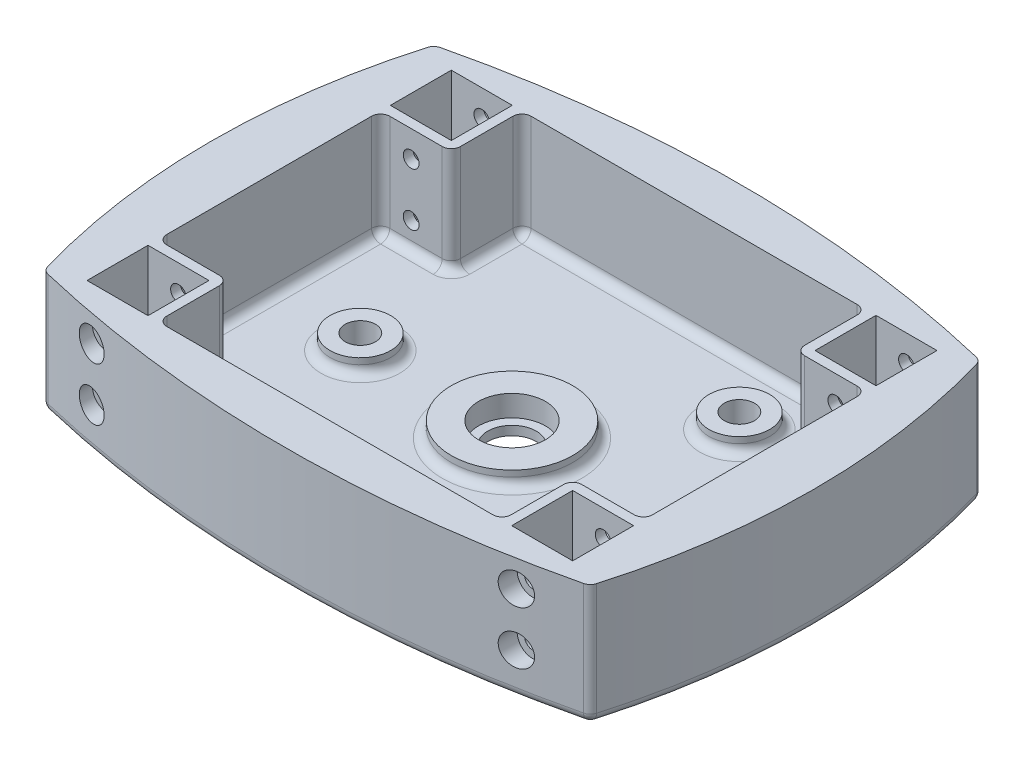
from build123d import *

# Parameters (mm, degrees)
SKETCH1_W           = 20.1
SKETCH1_H           = 20.1
BOSS_EXTRUDE1_DEPTH = 40
SKETCH1_3_R         = 10
SKETCH1_3_R_2       = 20
BOSS_EXTRUDE2_DEPTH = 5
SKETCH1_4_R         = 11
SKETCH1_4_R_2       = 8
SKETCH1_4_W         = 20.1
SKETCH1_4_H         = 20.1
BOSS_EXTRUDE3_DEPTH = 3
SKETCH2_R           = 5.05
CUT_EXTRUDE1_DEPTH  = 62
SKETCH1_6_R         = 20
SKETCH1_6_R_2       = 11
SKETCH1_6_R_3       = 10
SKETCH1_6_R_4       = 5
BOSS_EXTRUDE4_DEPTH = 10
SKETCH2_3_R         = 5.05
SKETCH2_3_R_2       = 2.6
BOSS_EXTRUDE5_DEPTH = 26.5
SKETCH2_4_R         = 5.05
SKETCH2_4_R_2       = 2.6
CUT_EXTRUDE2_DEPTH  = 23.3
SKETCH2_5_R         = 5.05
SKETCH2_5_R_2       = 2.6
BOSS_EXTRUDE6_DEPTH = 3.2
SKETCH2_6_R         = 5.05
SKETCH2_6_R_2       = 2.6
CUT_EXTRUDE3_DEPTH  = 127.2
SKETCH2_7_R         = 5.05
SKETCH2_7_R_2       = 2.6
BOSS_EXTRUDE7_DEPTH = 100
SKETCH2_8_R         = 5.05
SKETCH2_8_R_2       = 2.6
CUT_EXTRUDE4_DEPTH  = 96.8
SKETCH2_9_R         = 5.05
SKETCH2_9_R_2       = 2.6
BOSS_EXTRUDE8_DEPTH = 76.7
SKETCH2_10_R        = 5.05
SKETCH2_10_R_2      = 2.6
CUT_EXTRUDE5_DEPTH  = 73.5
FILLET1_R           = 3


with BuildPart() as part:
    # Sketch1 → Boss-Extrude1 (new body)
    with BuildSketch(Plane(origin=(0, 0, 0), x_dir=(1, 0, 0), z_dir=(0, 1, 0))):
        with BuildLine():
            ThreePointArc((-160, 14.285714286), (-70, 25.097415446), (20, 14.285714286))
            ThreePointArc((20, 14.285714286), (29.379159313, -50), (20, -114.285714286))
            ThreePointArc((20, -114.285714286), (-70, -125.097415446), (-160, -114.285714286))
            ThreePointArc((-160, -114.285714286), (-169.379159313, -50), (-160, 14.285714286))
        make_face()
        with Locations((-140, 0)):
            Rectangle(SKETCH1_W, SKETCH1_H, mode=Mode.SUBTRACT)
        Rectangle(SKETCH1_W, SKETCH1_H, mode=Mode.SUBTRACT)
        with Locations((-140, -100)):
            Rectangle(SKETCH1_W, SKETCH1_H, mode=Mode.SUBTRACT)
        with Locations((0, -100)):
            Rectangle(SKETCH1_W, SKETCH1_H, mode=Mode.SUBTRACT)
        Polygon((-126.75, 10.05), (-126.75, -13.25), (-150.05, -13.25), (-150.05, -86.75), (-126.75, -86.75), (-126.75, -110.05), (-13.25, -110.05), (-13.25, -86.75), (10.05, -86.75), (10.05, -13.25), (-13.25, -13.25), (-13.25, 10.05), align=None, mode=Mode.SUBTRACT)
    extrude(amount=BOSS_EXTRUDE1_DEPTH)

    # Sketch1<3> → Boss-Extrude2 (add)
    with BuildSketch(Plane(origin=(0, 0, 0), x_dir=(1, 0, 0), z_dir=(0, 1, 0))):
        Polygon((-13.25, 10.05), (-126.75, 10.05), (-126.75, -13.25), (-150.05, -13.25), (-150.05, -86.75), (-126.75, -86.75), (-126.75, -110.05), (-13.25, -110.05), (-13.25, -86.75), (10.05, -86.75), (10.05, -13.25), (-13.25, -13.25), align=None)
        with Locations(Location((-120, -50, 0), (0, 0, 270))):
            Circle(SKETCH1_3_R, mode=Mode.SUBTRACT)
        with Locations(Location((-70, -50, 0), (0, 0, 270))):
            Circle(SKETCH1_3_R_2, mode=Mode.SUBTRACT)
        with Locations(Location((-35, -89.95, 0), (0, 0, 270))):
            Circle(SKETCH1_3_R, mode=Mode.SUBTRACT)
        with Locations(Location((-35, -10.05, 0), (0, 0, 270))):
            Circle(SKETCH1_3_R, mode=Mode.SUBTRACT)
    extrude(amount=BOSS_EXTRUDE2_DEPTH)

    # Sketch1<4> → Boss-Extrude3 (add)
    # profile 1 of 5: a face of its own
    with BuildSketch(Plane(origin=(0, 0, 0), x_dir=(1, 0, 0), z_dir=(0, 1, 0))):
        with Locations(Location((-70, -50, 0), (0, 0, 270))):
            Circle(SKETCH1_4_R)
        with Locations(Location((-70, -50, 0), (0, 0, 270))):
            Circle(SKETCH1_4_R_2, mode=Mode.SUBTRACT)
    # profile 2 of 5: a face of its own
    with BuildSketch(Plane(origin=(0, 0, 0), x_dir=(1, 0, 0), z_dir=(0, 1, 0))):
        with Locations((-140, 0)):
            Rectangle(SKETCH1_4_W, SKETCH1_4_H)
    # profile 3 of 5: a face of its own
    with BuildSketch(Plane(origin=(0, 0, 0), x_dir=(1, 0, 0), z_dir=(0, 1, 0))):
        with Locations((-140, -100)):
            Rectangle(SKETCH1_4_W, SKETCH1_4_H)
    # profile 4 of 5: a face of its own
    with BuildSketch(Plane(origin=(0, 0, 0), x_dir=(1, 0, 0), z_dir=(0, 1, 0))):
        Rectangle(SKETCH1_4_W, SKETCH1_4_H)
    # profile 5 of 5: a face of its own
    with BuildSketch(Plane(origin=(0, 0, 0), x_dir=(1, 0, 0), z_dir=(0, 1, 0))):
        with Locations((0, -100)):
            Rectangle(SKETCH1_4_W, SKETCH1_4_H)
    extrude(amount=BOSS_EXTRUDE3_DEPTH)


with BuildPart() as boss_extrude3_piece_1:
    # of the separate pieces the step leaves, piece 1, a body of its own (boss_extrude3_pieces)
    add(part.part.solids().sort_by_distance((-160, 0, 114.285714286))[0])

    # Sketch2 → Cut-Extrude1 (cut)
    with BuildSketch(Plane.XY.offset(13.25)):
        with Locations((0, 13.75)):
            Circle(SKETCH2_R)
        with Locations((0, 31.25)):
            Circle(SKETCH2_R)
        with Locations((-140, 31.25)):
            Circle(SKETCH2_R)
        with Locations((-140, 13.75)):
            Circle(SKETCH2_R)
    extrude(amount=-CUT_EXTRUDE1_DEPTH, mode=Mode.SUBTRACT)



with BuildPart() as boss_extrude3_piece_2:
    # of the separate pieces the step leaves, piece 2, a body of its own (boss_extrude3_pieces)
    add(part.part.solids().sort_by_distance((-70, 0, 61))[0])


with BuildPart() as boss_extrude3_piece_1_1:
    add(boss_extrude3_piece_1.part)

    add(boss_extrude3_piece_2.part)  # Boss-Extrude4 merges Boss-Extrude3 piece 2
    # Sketch1<6> → Boss-Extrude4 (add)
    # profile 1 of 4: a face of its own
    with BuildSketch(Plane(origin=(0, 0, 0), x_dir=(1, 0, 0), z_dir=(0, 1, 0))):
        with Locations(Location((-70, -50, 0), (0, 0, 270))):
            Circle(SKETCH1_6_R)
        with Locations(Location((-70, -50, 0), (0, 0, 270))):
            Circle(SKETCH1_6_R_2, mode=Mode.SUBTRACT)
    # profile 2 of 4: a face of its own
    with BuildSketch(Plane(origin=(0, 0, 0), x_dir=(1, 0, 0), z_dir=(0, 1, 0))):
        with Locations(Location((-120, -50, 0), (0, 0, 270))):
            Circle(SKETCH1_6_R_3)
        with Locations(Location((-120, -50, 0), (0, 0, 270))):
            Circle(SKETCH1_6_R_4, mode=Mode.SUBTRACT)
    # profile 3 of 4: a face of its own
    with BuildSketch(Plane(origin=(0, 0, 0), x_dir=(1, 0, 0), z_dir=(0, 1, 0))):
        with Locations(Location((-35, -10.05, 0), (0, 0, 270))):
            Circle(SKETCH1_6_R_3)
        with Locations(Location((-35, -10.05, 0), (0, 0, 270))):
            Circle(SKETCH1_6_R_4, mode=Mode.SUBTRACT)
    # profile 4 of 4: a face of its own
    with BuildSketch(Plane(origin=(0, 0, 0), x_dir=(1, 0, 0), z_dir=(0, 1, 0))):
        with Locations(Location((-35, -89.95, 0), (0, 0, 270))):
            Circle(SKETCH1_6_R_3)
        with Locations(Location((-35, -89.95, 0), (0, 0, 270))):
            Circle(SKETCH1_6_R_4, mode=Mode.SUBTRACT)
    extrude(amount=BOSS_EXTRUDE4_DEPTH)

    # Sketch2<3> → Boss-Extrude5 (add)
    # profile 1 of 4: a face of its own
    with BuildSketch(Plane.XY.offset(13.25)):
        with Locations((0, 13.75)):
            Circle(SKETCH2_3_R)
        with Locations((0, 13.75)):
            Circle(SKETCH2_3_R_2, mode=Mode.SUBTRACT)
    # profile 2 of 4: a face of its own
    with BuildSketch(Plane.XY.offset(13.25)):
        with Locations((0, 31.25)):
            Circle(SKETCH2_3_R)
        with Locations((0, 31.25)):
            Circle(SKETCH2_3_R_2, mode=Mode.SUBTRACT)
    # profile 3 of 4: a face of its own
    with BuildSketch(Plane.XY.offset(13.25)):
        with Locations((-140, 31.25)):
            Circle(SKETCH2_3_R)
        with Locations((-140, 31.25)):
            Circle(SKETCH2_3_R_2, mode=Mode.SUBTRACT)
    # profile 4 of 4: a face of its own
    with BuildSketch(Plane.XY.offset(13.25)):
        with Locations((-140, 13.75)):
            Circle(SKETCH2_3_R)
        with Locations((-140, 13.75)):
            Circle(SKETCH2_3_R_2, mode=Mode.SUBTRACT)
    extrude(amount=-BOSS_EXTRUDE5_DEPTH)

    # Sketch2<4> → Cut-Extrude2 (cut)
    # profile 1 of 4: a face of its own
    with BuildSketch(Plane.XY.offset(13.25)):
        with Locations((0, 13.75)):
            Circle(SKETCH2_4_R)
        with Locations((0, 13.75)):
            Circle(SKETCH2_4_R_2, mode=Mode.SUBTRACT)
    # profile 2 of 4: a face of its own
    with BuildSketch(Plane.XY.offset(13.25)):
        with Locations((0, 31.25)):
            Circle(SKETCH2_4_R)
        with Locations((0, 31.25)):
            Circle(SKETCH2_4_R_2, mode=Mode.SUBTRACT)
    # profile 3 of 4: a face of its own
    with BuildSketch(Plane.XY.offset(13.25)):
        with Locations((-140, 31.25)):
            Circle(SKETCH2_4_R)
        with Locations((-140, 31.25)):
            Circle(SKETCH2_4_R_2, mode=Mode.SUBTRACT)
    # profile 4 of 4: a face of its own
    with BuildSketch(Plane.XY.offset(13.25)):
        with Locations((-140, 13.75)):
            Circle(SKETCH2_4_R)
        with Locations((-140, 13.75)):
            Circle(SKETCH2_4_R_2, mode=Mode.SUBTRACT)
    extrude(amount=-CUT_EXTRUDE2_DEPTH, mode=Mode.SUBTRACT)

    # Sketch2<5> → Boss-Extrude6 (add)
    # profile 1 of 4: a face of its own
    with BuildSketch(Plane.XY.offset(13.25)):
        with Locations((0, 13.75)):
            Circle(SKETCH2_5_R)
        with Locations((0, 13.75)):
            Circle(SKETCH2_5_R_2, mode=Mode.SUBTRACT)
    # profile 2 of 4: a face of its own
    with BuildSketch(Plane.XY.offset(13.25)):
        with Locations((0, 31.25)):
            Circle(SKETCH2_5_R)
        with Locations((0, 31.25)):
            Circle(SKETCH2_5_R_2, mode=Mode.SUBTRACT)
    # profile 3 of 4: a face of its own
    with BuildSketch(Plane.XY.offset(13.25)):
        with Locations((-140, 31.25)):
            Circle(SKETCH2_5_R)
        with Locations((-140, 31.25)):
            Circle(SKETCH2_5_R_2, mode=Mode.SUBTRACT)
    # profile 4 of 4: a face of its own
    with BuildSketch(Plane.XY.offset(13.25)):
        with Locations((-140, 13.75)):
            Circle(SKETCH2_5_R)
        with Locations((-140, 13.75)):
            Circle(SKETCH2_5_R_2, mode=Mode.SUBTRACT)
    extrude(amount=-BOSS_EXTRUDE6_DEPTH)

    # Sketch2<6> → Cut-Extrude3 (cut)
    # profile 1 of 8: a face of its own
    with BuildSketch(Plane.XY.offset(13.25)):
        with Locations((-140, 31.25)):
            Circle(SKETCH2_6_R)
        with Locations((-140, 31.25)):
            Circle(SKETCH2_6_R_2, mode=Mode.SUBTRACT)
    # profile 2 of 8: a face of its own
    with BuildSketch(Plane.XY.offset(13.25)):
        with Locations((-140, 13.75)):
            Circle(SKETCH2_6_R)
        with Locations((-140, 13.75)):
            Circle(SKETCH2_6_R_2, mode=Mode.SUBTRACT)
    # profile 3 of 8: a face of its own
    with BuildSketch(Plane.XY.offset(13.25)):
        with Locations((0, 31.25)):
            Circle(SKETCH2_6_R)
        with Locations((0, 31.25)):
            Circle(SKETCH2_6_R_2, mode=Mode.SUBTRACT)
    # profile 4 of 8: a face of its own
    with BuildSketch(Plane.XY.offset(13.25)):
        with Locations((0, 13.75)):
            Circle(SKETCH2_6_R)
        with Locations((0, 13.75)):
            Circle(SKETCH2_6_R_2, mode=Mode.SUBTRACT)
    # profile 5 of 8: a face of its own
    with BuildSketch(Plane.XY.offset(13.25)):
        with Locations((0, 31.25)):
            Circle(SKETCH2_6_R_2)
    # profile 6 of 8: a face of its own
    with BuildSketch(Plane.XY.offset(13.25)):
        with Locations((0, 13.75)):
            Circle(SKETCH2_6_R_2)
    # profile 7 of 8: a face of its own
    with BuildSketch(Plane.XY.offset(13.25)):
        with Locations((-140, 13.75)):
            Circle(SKETCH2_6_R_2)
    # profile 8 of 8: a face of its own
    with BuildSketch(Plane.XY.offset(13.25)):
        with Locations((-140, 31.25)):
            Circle(SKETCH2_6_R_2)
    extrude(amount=CUT_EXTRUDE3_DEPTH, mode=Mode.SUBTRACT)

    # Sketch2<7> → Boss-Extrude7 (add)
    # profile 1 of 4: a face of its own
    with BuildSketch(Plane.XY.offset(13.25)):
        with Locations((-140, 13.75)):
            Circle(SKETCH2_7_R)
        with Locations((-140, 13.75)):
            Circle(SKETCH2_7_R_2, mode=Mode.SUBTRACT)
    # profile 2 of 4: a face of its own
    with BuildSketch(Plane.XY.offset(13.25)):
        with Locations((-140, 31.25)):
            Circle(SKETCH2_7_R)
        with Locations((-140, 31.25)):
            Circle(SKETCH2_7_R_2, mode=Mode.SUBTRACT)
    # profile 3 of 4: a face of its own
    with BuildSketch(Plane.XY.offset(13.25)):
        with Locations((0, 13.75)):
            Circle(SKETCH2_7_R)
        with Locations((0, 13.75)):
            Circle(SKETCH2_7_R_2, mode=Mode.SUBTRACT)
    # profile 4 of 4: a face of its own
    with BuildSketch(Plane.XY.offset(13.25)):
        with Locations((0, 31.25)):
            Circle(SKETCH2_7_R)
        with Locations((0, 31.25)):
            Circle(SKETCH2_7_R_2, mode=Mode.SUBTRACT)
    extrude(amount=BOSS_EXTRUDE7_DEPTH)

    # Sketch2<8> → Cut-Extrude4 (cut)
    # profile 1 of 4: a face of its own
    with BuildSketch(Plane.XY.offset(13.25)):
        with Locations((0, 13.75)):
            Circle(SKETCH2_8_R)
        with Locations((0, 13.75)):
            Circle(SKETCH2_8_R_2, mode=Mode.SUBTRACT)
    # profile 2 of 4: a face of its own
    with BuildSketch(Plane.XY.offset(13.25)):
        with Locations((0, 31.25)):
            Circle(SKETCH2_8_R)
        with Locations((0, 31.25)):
            Circle(SKETCH2_8_R_2, mode=Mode.SUBTRACT)
    # profile 3 of 4: a face of its own
    with BuildSketch(Plane.XY.offset(13.25)):
        with Locations((-140, 31.25)):
            Circle(SKETCH2_8_R)
        with Locations((-140, 31.25)):
            Circle(SKETCH2_8_R_2, mode=Mode.SUBTRACT)
    # profile 4 of 4: a face of its own
    with BuildSketch(Plane.XY.offset(13.25)):
        with Locations((-140, 13.75)):
            Circle(SKETCH2_8_R)
        with Locations((-140, 13.75)):
            Circle(SKETCH2_8_R_2, mode=Mode.SUBTRACT)
    extrude(amount=CUT_EXTRUDE4_DEPTH, mode=Mode.SUBTRACT)

    # Sketch2<9> → Boss-Extrude8 (add)
    # profile 1 of 4: a face of its own
    with BuildSketch(Plane.XY.offset(13.25)):
        with Locations((0, 13.75)):
            Circle(SKETCH2_9_R)
        with Locations(Location((0, 13.75, 0), (0, 0, 180))):
            Circle(SKETCH2_9_R_2, mode=Mode.SUBTRACT)
    # profile 2 of 4: a face of its own
    with BuildSketch(Plane.XY.offset(13.25)):
        with Locations((0, 31.25)):
            Circle(SKETCH2_9_R)
        with Locations(Location((0, 31.25, 0), (0, 0, 180))):
            Circle(SKETCH2_9_R_2, mode=Mode.SUBTRACT)
    # profile 3 of 4: a face of its own
    with BuildSketch(Plane.XY.offset(13.25)):
        with Locations((-140, 31.25)):
            Circle(SKETCH2_9_R)
        with Locations(Location((-140, 31.25, 0), (0, 0, 180))):
            Circle(SKETCH2_9_R_2, mode=Mode.SUBTRACT)
    # profile 4 of 4: a face of its own
    with BuildSketch(Plane.XY.offset(13.25)):
        with Locations((-140, 13.75)):
            Circle(SKETCH2_9_R)
        with Locations(Location((-140, 13.75, 0), (0, 0, 180))):
            Circle(SKETCH2_9_R_2, mode=Mode.SUBTRACT)
    extrude(amount=BOSS_EXTRUDE8_DEPTH)

    # Sketch2<10> → Cut-Extrude5 (cut)
    # profile 1 of 8: a face of its own
    with BuildSketch(Plane.XY.offset(13.25)):
        with Locations((-140, 31.25)):
            Circle(SKETCH2_10_R)
        with Locations((-140, 31.25)):
            Circle(SKETCH2_10_R_2, mode=Mode.SUBTRACT)
    # profile 2 of 8: a face of its own
    with BuildSketch(Plane.XY.offset(13.25)):
        with Locations((-140, 31.25)):
            Circle(SKETCH2_10_R_2)
    # profile 3 of 8: a face of its own
    with BuildSketch(Plane.XY.offset(13.25)):
        with Locations((-140, 13.75)):
            Circle(SKETCH2_10_R)
        with Locations((-140, 13.75)):
            Circle(SKETCH2_10_R_2, mode=Mode.SUBTRACT)
    # profile 4 of 8: a face of its own
    with BuildSketch(Plane.XY.offset(13.25)):
        with Locations((-140, 13.75)):
            Circle(SKETCH2_10_R_2)
    # profile 5 of 8: a face of its own
    with BuildSketch(Plane.XY.offset(13.25)):
        with Locations((0, 31.25)):
            Circle(SKETCH2_10_R)
        with Locations((0, 31.25)):
            Circle(SKETCH2_10_R_2, mode=Mode.SUBTRACT)
    # profile 6 of 8: a face of its own
    with BuildSketch(Plane.XY.offset(13.25)):
        with Locations((0, 31.25)):
            Circle(SKETCH2_10_R_2)
    # profile 7 of 8: a face of its own
    with BuildSketch(Plane.XY.offset(13.25)):
        with Locations((0, 13.75)):
            Circle(SKETCH2_10_R)
        with Locations((0, 13.75)):
            Circle(SKETCH2_10_R_2, mode=Mode.SUBTRACT)
    # profile 8 of 8: a face of its own
    with BuildSketch(Plane.XY.offset(13.25)):
        with Locations((0, 13.75)):
            Circle(SKETCH2_10_R_2)
    extrude(amount=CUT_EXTRUDE5_DEPTH, mode=Mode.SUBTRACT)

    # Fillet1
    fillet1_edges = [boss_extrude3_piece_1_1.edges().sort_by_distance(p)[0] for p in [
        (-150.05, 22.5, 86.75),
        (-150.05, 22.5, 13.25),
        (-126.75, 22.5, 13.25),
        (-126.75, 22.5, -10.05),
        (-70, 5, -10.05),
        (-13.25, 22.5, -10.05),
        (-13.25, 5, 1.6),
        (-13.25, 22.5, 13.25),
        (-1.6, 5, 13.25),
        (10.05, 22.5, 13.25),
        (10.05, 5, 50),
        (10.05, 22.5, 86.75),
        (-13.25, 22.5, 86.75),
        (-13.25, 22.5, 110.05),
        (-126.75, 22.5, 110.05),
        (20, 20, 114.285714286),
        (20, 20, -14.285714286),
        (-169.379159313, 0, 50),
        (-160, 20, -14.285714286),
        (-126.75, 22.5, 86.75),
        (-70, 0, 125.097415446),
        (-160, 20, 114.285714286),
        (29.379159313, 0, 50),
        (-70, 0, -25.097415446),
        (-70, 5, 30),
        (-120, 5, 40),
        (-35, 5, 0.05),
        (-35, 5, 79.95),
        (-138.4, 5, 13.25),
        (-150.05, 5, 50),
        (-138.4, 5, 86.75),
        (-126.75, 5, 98.4),
        (-70, 5, 110.05),
        (-13.25, 5, 98.4),
        (-1.6, 5, 86.75),
        (-126.75, 5, 1.6),
    ]]
    fillet(fillet1_edges, radius=FILLET1_R)


solid = boss_extrude3_piece_1_1.part
